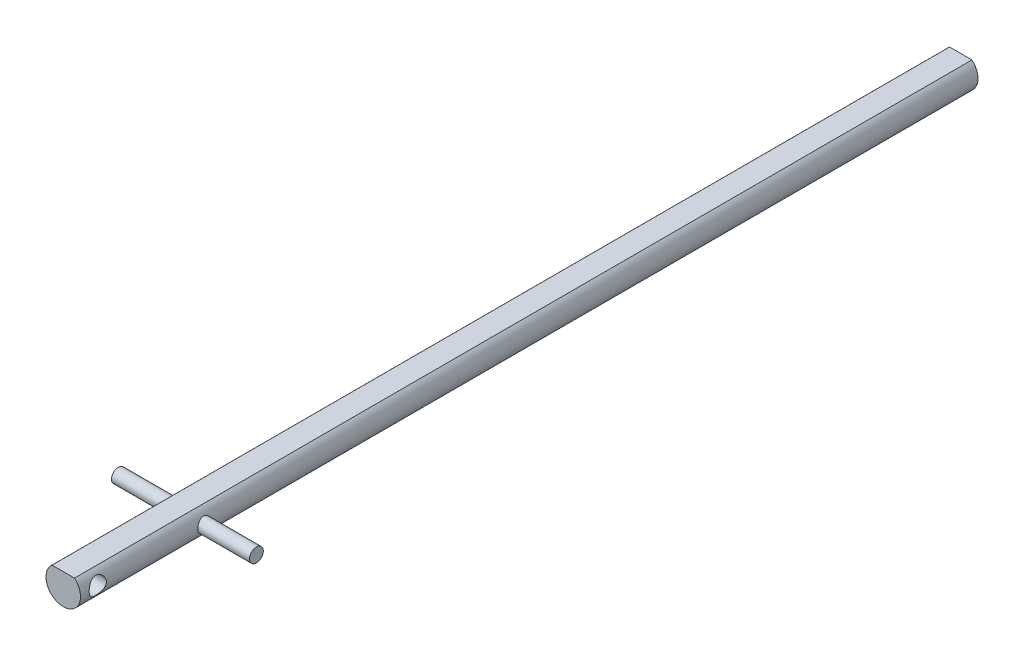
from build123d import *

# Parameters (mm, degrees)
BOSS_EXTRU_1_DEPTH           = 260
ENL_V_MAT_EXTRU_1_DEPTH      = 261.096136073
ENL_V_MAT_EXTRU_1_DEPTH_BACK = 261.096136073
ESQUISSE2_R                  = 2.5
ESQUISSE3_R                  = 2
BOSS_EXTRU_2_DEPTH           = 20


with BuildPart() as part:
    # Esquisse1 → Boss.-Extru.1 (new body)
    with BuildSketch(Plane.XY):
        with BuildLine():
            Line((-3.249615362, 3.8), (3.249615362, 3.8))
            ThreePointArc((3.249615362, 3.8), (0, -5), (-3.249615362, 3.8))
        make_face()
    extrude(amount=BOSS_EXTRU_1_DEPTH)

    # Esquisse2 → Enlèv. mat.-Extru.1 (cut, two sides: drawn at the far end of the back side and taken through both)
    with BuildSketch(Plane(origin=(0, 0, 0), x_dir=(0, 0, -1), z_dir=(1, 0, 0)).offset(-ENL_V_MAT_EXTRU_1_DEPTH_BACK)):
        with Locations((-255, 0)):
            Circle(ESQUISSE2_R)
    extrude(amount=ENL_V_MAT_EXTRU_1_DEPTH + ENL_V_MAT_EXTRU_1_DEPTH_BACK, mode=Mode.SUBTRACT)

    # Esquisse3 → Boss.-Extru.2 (add, symmetric)
    with BuildSketch(Plane(origin=(0, 0, 0), x_dir=(0, 0, -1), z_dir=(1, 0, 0))):
        with Locations(Location((-224.038713001, 0, 0), (0, 0, 180))):
            Circle(ESQUISSE3_R)
    extrude(amount=BOSS_EXTRU_2_DEPTH, both=True)


solid = part.part
